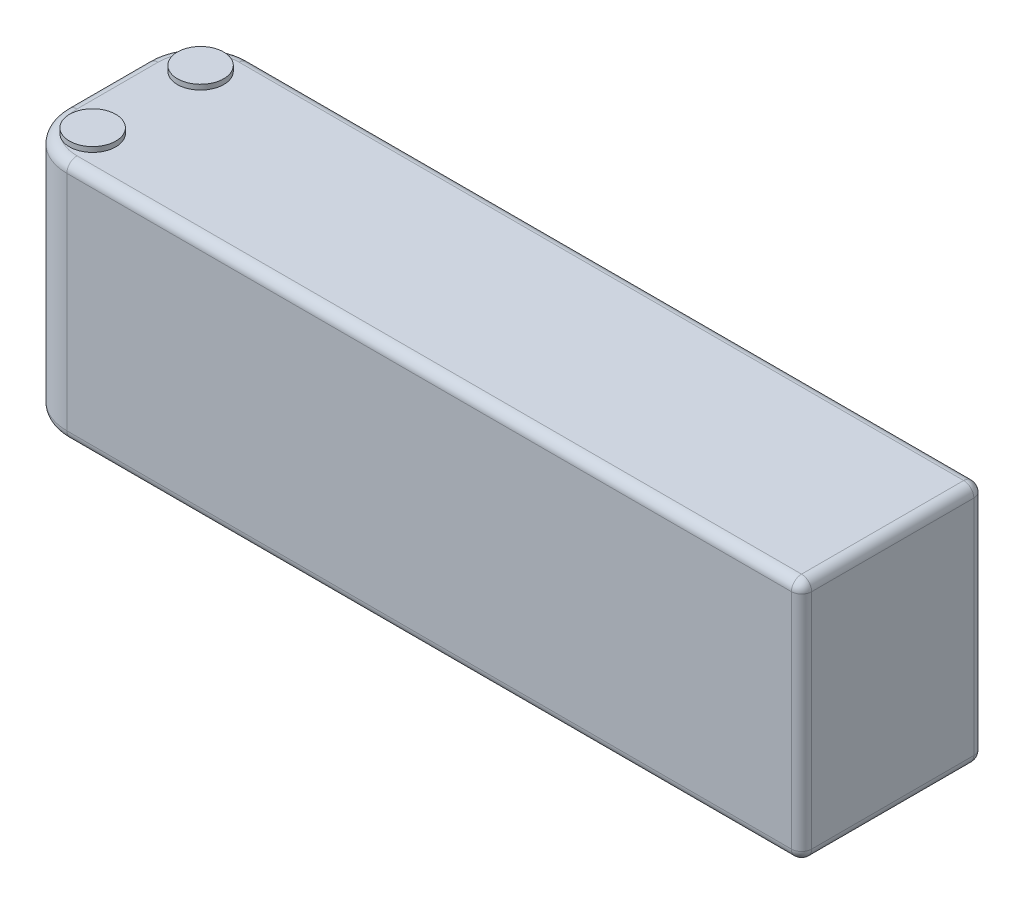
from build123d import *

# Parameters (mm, degrees)
BOSS_EXTRUDE1_DEPTH = 48
FILLET1_R           = 2
SKETCH7_R           = 4.572679887
BOSS_EXTRUDE3_DEPTH = 1
L_EK1_SCALE         = 0.5


with BuildPart() as part:
    # Sketch3 → Boss-Extrude1 (new body)
    with BuildSketch(Plane(origin=(0, 0, 0), x_dir=(1, 0, 0), z_dir=(0, 1, 0))):
        with BuildLine():
            Line((10, 0), (155, 0))
            Line((155, 0), (155, 36))
            Line((155, 36), (10, 36))
            ThreePointArc((10, 36), (2.928932188, 33.071067812), (0, 26))
            Line((0, 26), (0, 10))
            ThreePointArc((0, 10), (2.928932188, 2.928932188), (10, 0))
        make_face()
    extrude(amount=BOSS_EXTRUDE1_DEPTH)

    # Fillet1
    fillet1_edges = [part.edges().sort_by_distance(p)[0] for p in [
        (155, 24, 0),
        (155, 24, -36),
        (2.928932188, 48, -33.071067812),
        (0, 48, -18),
        (2.928932188, 48, -2.928932188),
        (82.5, 48, 0),
        (155, 48, -18),
        (82.5, 0, 0),
        (2.928932188, 0, -2.928932188),
        (0, 0, -18),
        (2.928932188, 0, -33.071067812),
        (82.5, 0, -36),
        (155, 0, -18),
        (82.5, 48, -36),
    ]]
    fillet(fillet1_edges, radius=FILLET1_R)

    # Sketch7 → Boss-Extrude3 (add)
    with BuildSketch(Plane(origin=(0, 48, 0), x_dir=(1, 0, 0), z_dir=(0, 1, 0))):
        with Locations(Location((7.738139678, 28.650889337, 0), (0, 0, 116.659797152))):
            Circle(SKETCH7_R)
        with Locations(Location((7.738139678, 7.349110663, 0), (0, 0, 90))):
            Circle(SKETCH7_R)
    extrude(amount=BOSS_EXTRUDE3_DEPTH)


with BuildPart() as part_1:
    # Ölçek1: scaled about (78.022697694, 24.012137282, -18)
    add(part.part.scale(L_EK1_SCALE).moved(Location((39.011348847, 12.006068641, -9))))


solid = part_1.part
